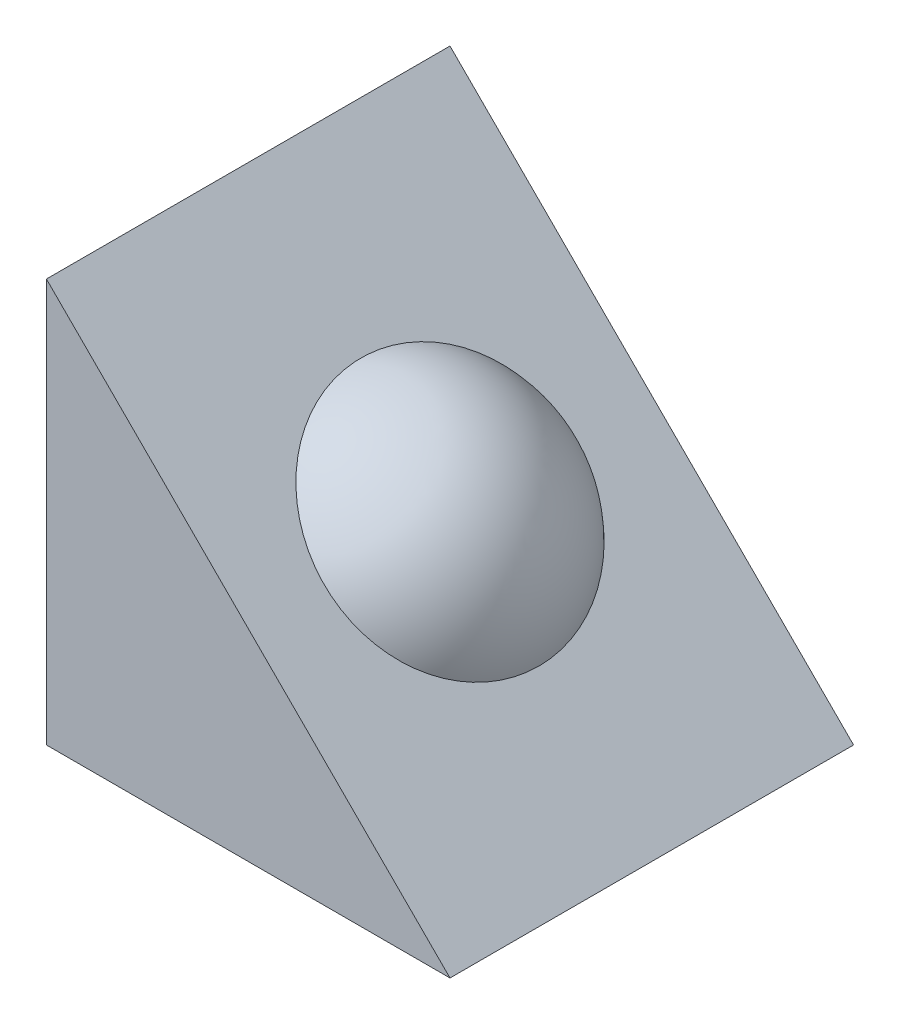
from build123d import *
from build123d.topology import SkipClean

# Parameters (mm, degrees)
BOSS_EXTRUDE1_DEPTH = 25


with BuildPart() as part:
    # Sketch1 → Boss-Extrude1 (new, symmetric)
    with BuildSketch(Plane.XY):
        Polygon((0, 0), (0, 50), (50, 0), align=None)
    extrude(amount=BOSS_EXTRUDE1_DEPTH, both=True)

    # Sketch2 → Revolve1 (revolve)
    with SkipClean():  # the faces are left unmerged after this step: merging them gives an invalid solid
        with BuildSketch(Plane.XY):
            with BuildLine():
                Line((5.908116908, 31.363961031), (31.363961031, 5.908116908))
                ThreePointArc((31.363961031, 5.908116908), (31.363961031, 31.363961031), (5.908116908, 31.363961031))
            make_face()
        revolve(axis=Axis((5.908116908, 31.363961031, 0), (0.7071067811865476, -0.7071067811865476, 0)))


solid = part.part
